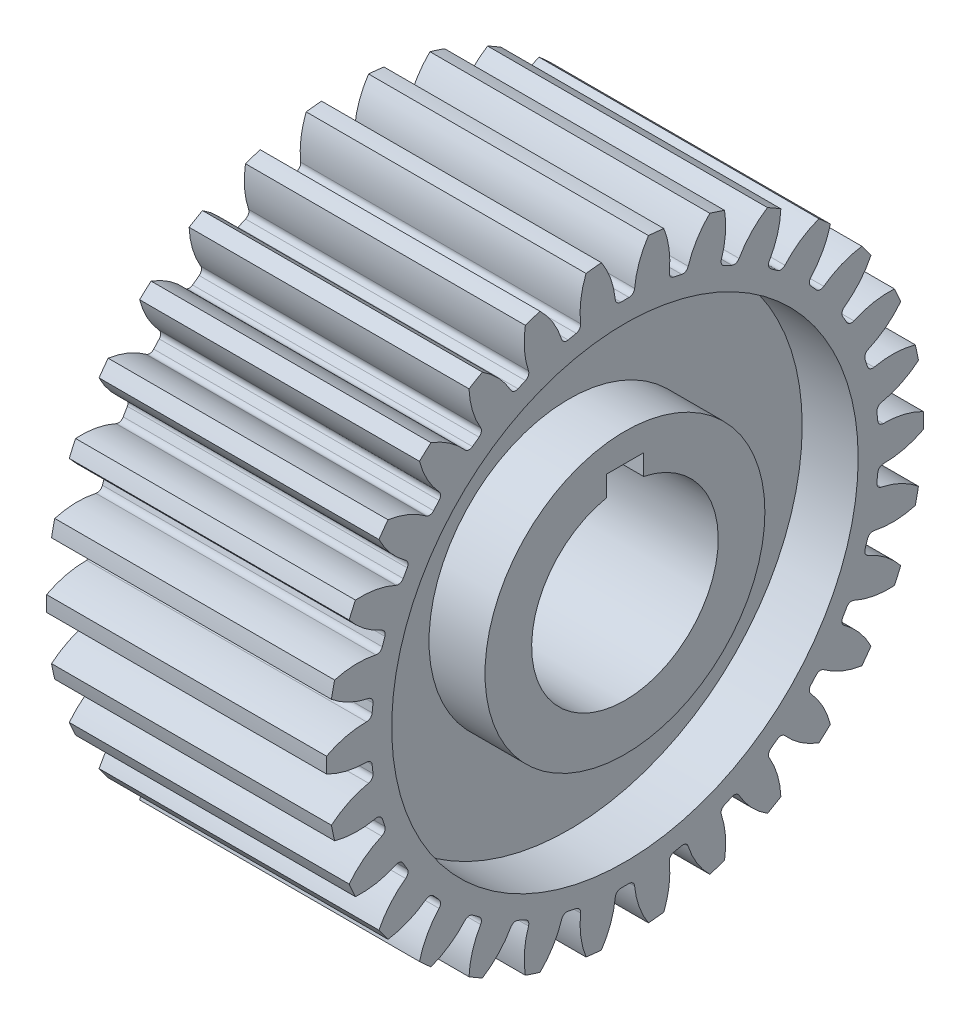
from build123d import *

# Parameters (mm, degrees)
SKETCH1_R           = 16
BOSS_EXTRUDE1_DEPTH = 7.5
CUT_EXTRUDE1_DEPTH  = 28.147743921
SKETCH3_R           = 12.5
SKETCH3_R_2         = 7.5
CUT_EXTRUDE2_DEPTH  = 3
CUT_EXTRUDE3_DEPTH  = 28.147743921
CIRPATTERN2_COUNT   = 30


with BuildPart() as part:
    # Sketch1 → Boss-Extrude1 (new, symmetric)
    with BuildSketch(Plane(origin=(0, 0, 0), x_dir=(0, 0, -1), z_dir=(1, 0, 0))):
        Circle(SKETCH1_R)
    extrude(amount=BOSS_EXTRUDE1_DEPTH, both=True)

    # Sketch2 → Cut-Extrude1 (cut, through all)
    with BuildSketch(Plane(origin=(7.5, 0, 0), x_dir=(0, 0, -1), z_dir=(1, 0, 0))):
        with BuildLine():
            Line((-1, 4.898979486), (-1, 6))
            Line((-1, 6), (1, 6))
            Line((1, 6), (1, 4.898979486))
            ThreePointArc((1, 4.898979486), (0, -5), (-1, 4.898979486))
        make_face()
    extrude(amount=-CUT_EXTRUDE1_DEPTH, mode=Mode.SUBTRACT)

    # Sketch3 → Cut-Extrude2 (cut)
    with BuildSketch(Plane(origin=(7.5, 0, 0), x_dir=(0, 0, -1), z_dir=(1, 0, 0))):
        Circle(SKETCH3_R)
        Circle(SKETCH3_R_2, mode=Mode.SUBTRACT)
    cut_extrude2 = extrude(amount=-CUT_EXTRUDE2_DEPTH, mode=Mode.SUBTRACT)

    # Mirror1: Cut-Extrude2 across plane
    add(cut_extrude2.mirror(Plane(origin=(0, 0, 0), x_dir=(0, 0, 1), z_dir=(1, 0, 0))), mode=Mode.SUBTRACT)

    # Sketch4 → Cut-Extrude3 (cut, through all)
    with BuildSketch(Plane(origin=(7.5, 0, 0), x_dir=(0, 0, -1), z_dir=(1, 0, 0))):
        with BuildLine():
            Line((-0.219874756, 13.6), (0.219874756, 13.6))
            ThreePointArc((0.219874756, 13.6), (0.421386888, 13.677754953), (0.518441911, 13.870714262))
            ThreePointArc((0.518441911, 13.870714262), (1.009154991, 15.525876188), (2.08, 16.88))
            ThreePointArc((2.08, 16.88), (0, 17.000581665), (-2.08, 16.88))
            ThreePointArc((-2.08, 16.88), (-1.009154991, 15.525876188), (-0.518441911, 13.870714262))
            ThreePointArc((-0.518441911, 13.870714262), (-0.421386888, 13.677754953), (-0.219874756, 13.6))
        make_face()
    cut_extrude3 = extrude(amount=-CUT_EXTRUDE3_DEPTH, mode=Mode.SUBTRACT)

    # CirPattern2: Cut-Extrude3 ×30 about axis
    cirpattern2_axis = Axis((0, 0, 0), (1, 0, 0))
    for i in range(1, CIRPATTERN2_COUNT):
        add(cut_extrude3.rotate(cirpattern2_axis, i * 360 / CIRPATTERN2_COUNT), mode=Mode.SUBTRACT)


solid = part.part
